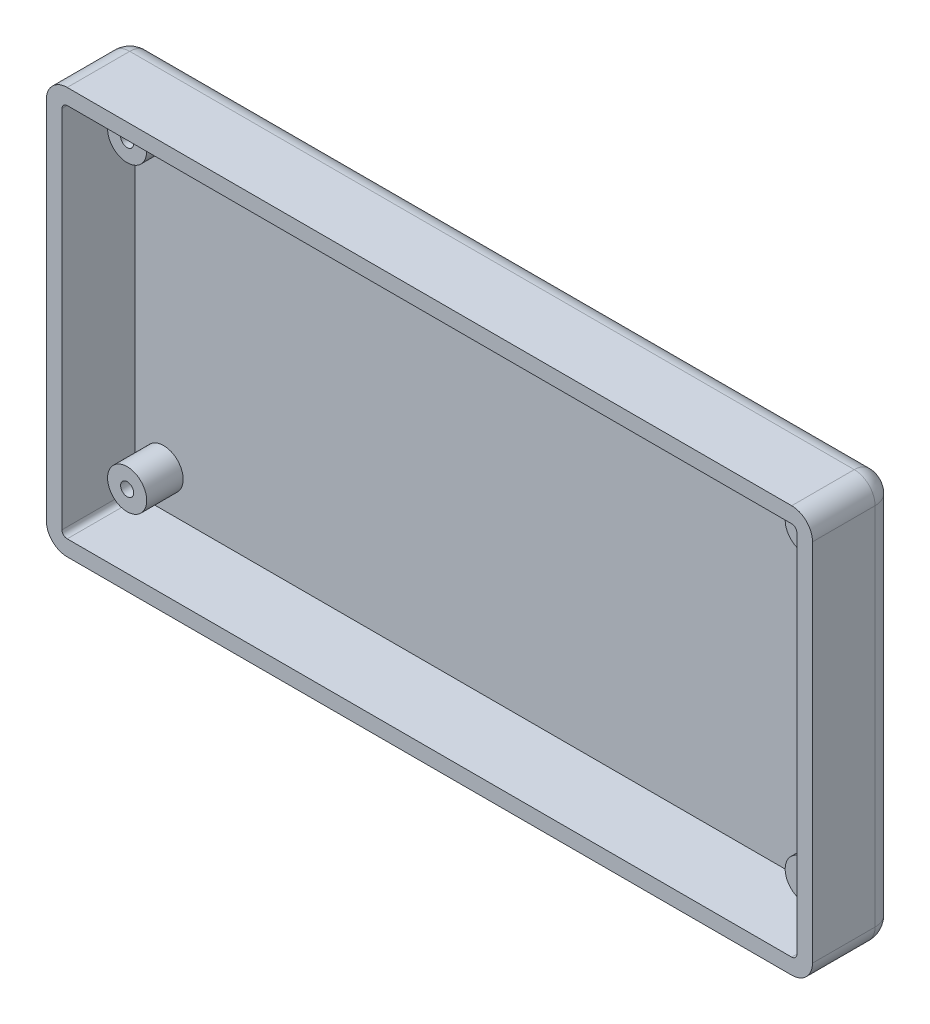
from build123d import *

# Parameters (mm, degrees)
SKETCH1_W           = 147
SKETCH1_H           = 78
BOSS_EXTRUDE1_DEPTH = 16
FILLET1_R           = 4
FILLET2_R           = 4
CUT_EXTRUDE1_DEPTH  = 14
SKETCH3_R           = 3.75
SKETCH3_R_2         = 1.25
BOSS_EXTRUDE2_DEPTH = 7


with BuildPart() as part:
    # Sketch1 → Boss-Extrude1 (new body)
    with BuildSketch(Plane.XY):
        Rectangle(SKETCH1_W, SKETCH1_H)
    extrude(amount=BOSS_EXTRUDE1_DEPTH)

    # Fillet1
    fillet1_edges = [part.edges().sort_by_distance(p)[0] for p in [
        (73.5, -39, 8),
        (-73.5, -39, 8),
        (-73.5, 39, 8),
        (73.5, 39, 8),
    ]]
    fillet(fillet1_edges, radius=FILLET1_R)

    # Fillet2
    fillet2_edges = [part.edges().sort_by_distance(p)[0] for p in [
        (0, -39, 0),
        (73.5, 0, 0),
        (-73.5, 0, 0),
        (0, 39, 0),
        (-72.328427125, 37.828427125, 0),
        (72.328427125, 37.828427125, 0),
        (72.328427125, -37.828427125, 0),
        (-72.328427125, -37.828427125, 0),
    ]]
    fillet(fillet2_edges, radius=FILLET2_R)

    # Sketch2 → Cut-Extrude1 (cut)
    with BuildSketch(Plane.XY.offset(16)):
        with BuildLine():
            Line((-70.5, 35), (-70.5, -35))
            ThreePointArc((-70.5, -35), (-70.207106781, -35.707106781), (-69.5, -36))
            Line((-69.5, -36), (69.5, -36))
            ThreePointArc((69.5, -36), (70.207106781, -35.707106781), (70.5, -35))
            Line((70.5, -35), (70.5, 35))
            ThreePointArc((70.5, 35), (70.207106781, 35.707106781), (69.5, 36))
            Line((69.5, 36), (-69.5, 36))
            ThreePointArc((-69.5, 36), (-70.207106781, 35.707106781), (-70.5, 35))
        make_face()
    extrude(amount=-CUT_EXTRUDE1_DEPTH, mode=Mode.SUBTRACT)

    # Sketch3 → Boss-Extrude2 (add)
    # profile 1 of 4: a face of its own
    with BuildSketch(Plane.XY.offset(2)):
        with Locations((-65, 29)):
            Circle(SKETCH3_R)
        with Locations((-65, 29)):
            Circle(SKETCH3_R_2, mode=Mode.SUBTRACT)
    # profile 2 of 4: a face of its own
    with BuildSketch(Plane.XY.offset(2)):
        with Locations(Location((65, 29, 0), (0, 0, 180))):
            Circle(SKETCH3_R)
        with Locations(Location((65, 29, 0), (0, 0, 180))):
            Circle(SKETCH3_R_2, mode=Mode.SUBTRACT)
    # profile 3 of 4: a face of its own
    with BuildSketch(Plane.XY.offset(2)):
        with Locations((65, -29)):
            Circle(SKETCH3_R)
        with Locations((65, -29)):
            Circle(SKETCH3_R_2, mode=Mode.SUBTRACT)
    # profile 4 of 4: a face of its own
    with BuildSketch(Plane.XY.offset(2)):
        with Locations(Location((-65, -29, 0), (0, 0, 180))):
            Circle(SKETCH3_R)
        with Locations(Location((-65, -29, 0), (0, 0, 180))):
            Circle(SKETCH3_R_2, mode=Mode.SUBTRACT)
    extrude(amount=BOSS_EXTRUDE2_DEPTH)


solid = part.part
